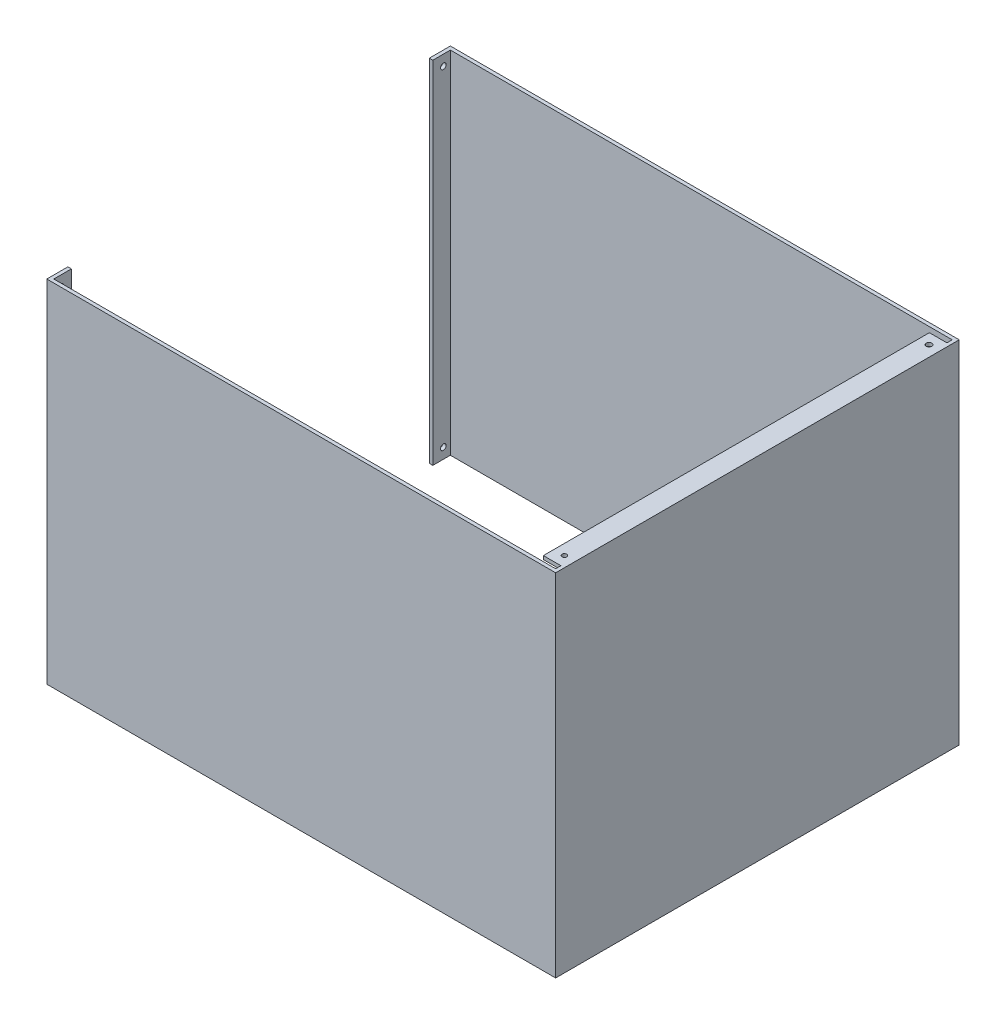
from build123d import *

# Parameters (mm, degrees)
SKETCH_1_W          = 290
SKETCH_1_H          = 230
EXTRUDE_1_DEPTH     = 200
SKETCH_2_W          = 286
SKETCH_2_H          = 226
CUT_EXTRUDE_1_DEPTH = 200
SKETCH_3_W          = 226
SKETCH_3_H          = 200
CUT_EXTRUDE_2_DEPTH = 2
SKETCH_5_W          = 10
SKETCH_5_H          = 220
EXTRUDE_2_DEPTH     = 2
SKETCH_6_R          = 1.6
CUT_EXTRUDE_3_DEPTH = 2
SKETCH_7_R          = 1.350525158
CUT_EXTRUDE_4_DEPTH = 2
SKETCH_8_W          = 10
SKETCH_8_H          = 200
EXTRUDE_3_DEPTH     = 2
SKETCH_9_R          = 1.6
CUT_EXTRUDE_5_DEPTH = 2
SKETCH_10_R         = 1.6
CUT_EXTRUDE_6_DEPTH = 2
SKETCH_11_W         = 10
SKETCH_11_H         = 200
EXTRUDE_4_DEPTH     = 2
SKETCH_12_R         = 1.6
CUT_EXTRUDE_7_DEPTH = 2
SKETCH_13_R         = 1.6
CUT_EXTRUDE_8_DEPTH = 2


with BuildPart() as part:
    # 草图1 → 凸台-拉伸1 (new body)
    with BuildSketch(Plane(origin=(0, 0, 0), x_dir=(1, 0, 0), z_dir=(0, 1, 0))):
        Rectangle(SKETCH_1_W, SKETCH_1_H)
    extrude(amount=EXTRUDE_1_DEPTH)

    # 草图2 → 切除-拉伸1 (cut)
    with BuildSketch(Plane(origin=(0, 200, 0), x_dir=(1, 0, 0), z_dir=(0, 1, 0))):
        Rectangle(SKETCH_2_W, SKETCH_2_H)
    extrude(amount=-CUT_EXTRUDE_1_DEPTH, mode=Mode.SUBTRACT)

    # 草图3 → 切除-拉伸2 (cut)
    with BuildSketch(Plane.ZY.offset(145)):
        with Locations((0, 100)):
            Rectangle(SKETCH_3_W, SKETCH_3_H)
    extrude(amount=-CUT_EXTRUDE_2_DEPTH, mode=Mode.SUBTRACT)

    # 草图5 → 凸台-拉伸2 (add)
    with BuildSketch(Plane(origin=(0, 200, 0), x_dir=(1, 0, 0), z_dir=(0, 1, 0))):
        with Locations((138, 0)):
            Rectangle(SKETCH_5_W, SKETCH_5_H)
    extrude(amount=-EXTRUDE_2_DEPTH)

    # 草图6 → 切除-拉伸3 (cut)
    with BuildSketch(Plane(origin=(0, 200, 0), x_dir=(1, 0, 0), z_dir=(0, 1, 0))):
        with Locations(Location((138.825354176, 104, 0), (0, 0, 270))):
            Circle(SKETCH_6_R)
    extrude(amount=-CUT_EXTRUDE_3_DEPTH, mode=Mode.SUBTRACT)

    # 草图7 → 切除-拉伸4 (cut)
    with BuildSketch(Plane(origin=(0, 200, 0), x_dir=(1, 0, 0), z_dir=(0, 1, 0))):
        with Locations(Location((139, -104, 0), (0, 0, 270))):
            Circle(SKETCH_7_R)
    extrude(amount=-CUT_EXTRUDE_4_DEPTH, mode=Mode.SUBTRACT)

    # 草图8 → 凸台-拉伸3 (add)
    with BuildSketch(Plane.ZY.offset(145)):
        with Locations((108, 100)):
            Rectangle(SKETCH_8_W, SKETCH_8_H)
    extrude(amount=-EXTRUDE_3_DEPTH)

    # 草图9 → 切除-拉伸5 (cut)
    with BuildSketch(Plane.ZY.offset(145)):
        with Locations((109, 194)):
            Circle(SKETCH_9_R)
    extrude(amount=-CUT_EXTRUDE_5_DEPTH, mode=Mode.SUBTRACT)

    # 草图10 → 切除-拉伸6 (cut)
    with BuildSketch(Plane.ZY.offset(145)):
        with Locations((109, 6)):
            Circle(SKETCH_10_R)
    extrude(amount=-CUT_EXTRUDE_6_DEPTH, mode=Mode.SUBTRACT)

    # 草图11 → 凸台-拉伸4 (add)
    with BuildSketch(Plane.ZY.offset(145)):
        with Locations((-108, 100)):
            Rectangle(SKETCH_11_W, SKETCH_11_H)
    extrude(amount=-EXTRUDE_4_DEPTH)

    # 草图12 → 切除-拉伸7 (cut)
    with BuildSketch(Plane.ZY.offset(145)):
        with Locations((-109, 194)):
            Circle(SKETCH_12_R)
    extrude(amount=-CUT_EXTRUDE_7_DEPTH, mode=Mode.SUBTRACT)

    # 草图13 → 切除-拉伸8 (cut)
    with BuildSketch(Plane.ZY.offset(145)):
        with Locations((-109, 6)):
            Circle(SKETCH_13_R)
    extrude(amount=-CUT_EXTRUDE_8_DEPTH, mode=Mode.SUBTRACT)


solid = part.part
